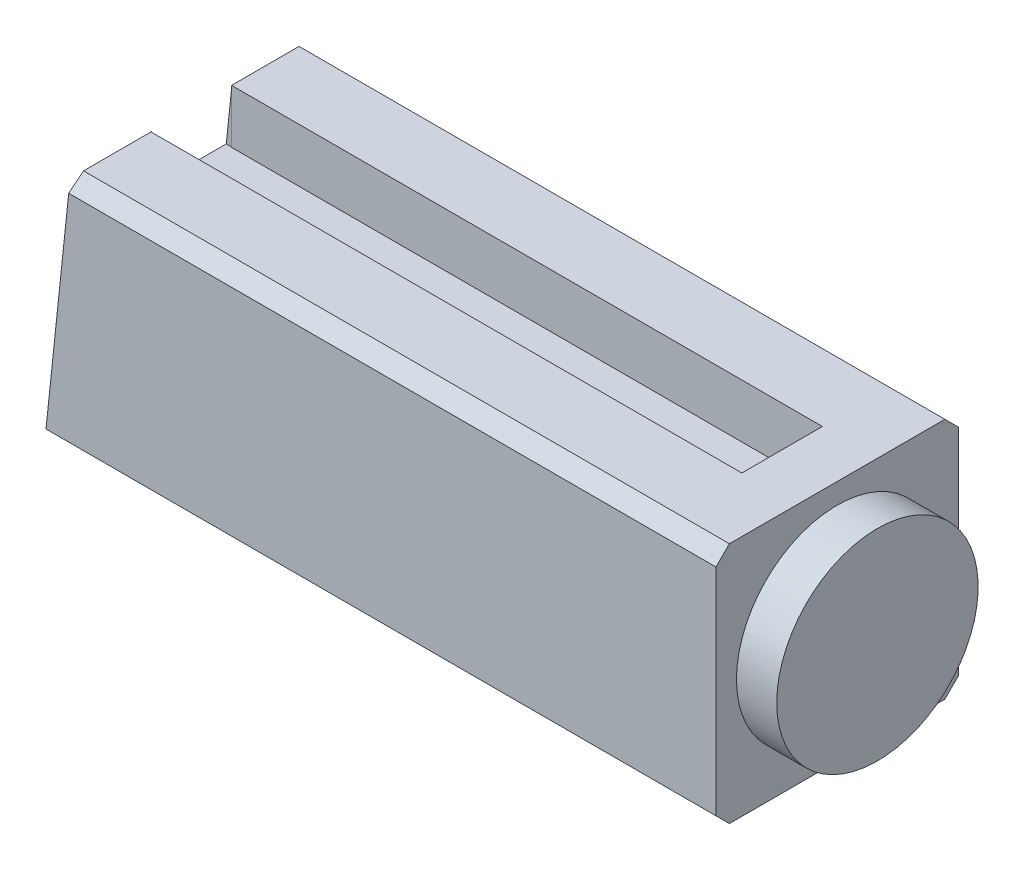
from build123d import *

# Parameters (mm, degrees)
SKETCH1_W           = 12.2174
SKETCH1_H           = 4.5847
BOSS_EXTRUDE1_DEPTH = 4.5847
SKETCH2_W           = 11.176
SKETCH2_H           = 1.524
CUT_EXTRUDE1_DEPTH  = 1.016
SKETCH4_W           = 1.524
SKETCH4_H           = 1.016
CUT_EXTRUDE3_DEPTH  = 14.249120928
SKETCH5_R           = 1.905
BOSS_EXTRUDE3_DEPTH = 0.762
CHAMFER1_SIZE       = 0.254
BOSS_EXTRUDE4_REACH = 9.861


with BuildPart() as part:
    # Sketch1 → Boss-Extrude1 (new body)
    with BuildSketch(Plane.XY):
        Polygon((-6.1087, 2.29235), (-6.5913, -2.29235), (-6.1087, -2.29235), align=None)
        Rectangle(SKETCH1_W, SKETCH1_H)
    extrude(amount=BOSS_EXTRUDE1_DEPTH)

    # Sketch2 → Cut-Extrude1 (cut)
    with BuildSketch(Plane(origin=(0, 2.29235, 0), x_dir=(1, 0, 0), z_dir=(0, 1, 0))):
        with Locations((-0.5207, -2.29235)):
            Rectangle(SKETCH2_W, SKETCH2_H)
    extrude(amount=-CUT_EXTRUDE1_DEPTH, mode=Mode.SUBTRACT)

    # Sketch4 → Cut-Extrude3 (cut, through all)
    with BuildSketch(Plane(origin=(-6.1087, 0, 0), x_dir=(0, 0, -1), z_dir=(1, 0, 0))):
        with Locations((-2.286, 1.78435)):
            Rectangle(SKETCH4_W, SKETCH4_H)
    extrude(amount=-CUT_EXTRUDE3_DEPTH, mode=Mode.SUBTRACT)

    # Sketch5 → Boss-Extrude3 (add)
    with BuildSketch(Plane(origin=(6.1087, 0, 0), x_dir=(0, 0, -1), z_dir=(1, 0, 0))):
        with Locations(Location((-2.29235, 0, 0), (0, 0, 180))):
            Circle(SKETCH5_R)
    extrude(amount=BOSS_EXTRUDE3_DEPTH)

    # Chamfer1
    chamfer1_edges = [part.edges().sort_by_distance(p)[0] for p in [
        (-0.2413, -2.29235, 4.5847),
        (0, 2.29235, 4.5847),
        (0, 2.29235, 0),
        (-0.2413, -2.29235, 0),
    ]]
    chamfer(chamfer1_edges, length=CHAMFER1_SIZE)

    # Sketch6 → Boss-Extrude4 (add, up to next)
    with BuildSketch(Plane.XY.offset(1.53035), mode=Mode.PRIVATE) as boss_extrude4_sk1:
        Polygon((5.0673, 2.29235), (5.0673, 1.27635), (4.0513, 1.27635), align=None)
    boss_extrude4_tool1 = extrude(boss_extrude4_sk1.sketch, amount=BOSS_EXTRUDE4_REACH, mode=Mode.PRIVATE) - part.part
    add(boss_extrude4_tool1.solids().sort_by_distance((4.728633, 1.615017, 1.53035))[0])


solid = part.part
